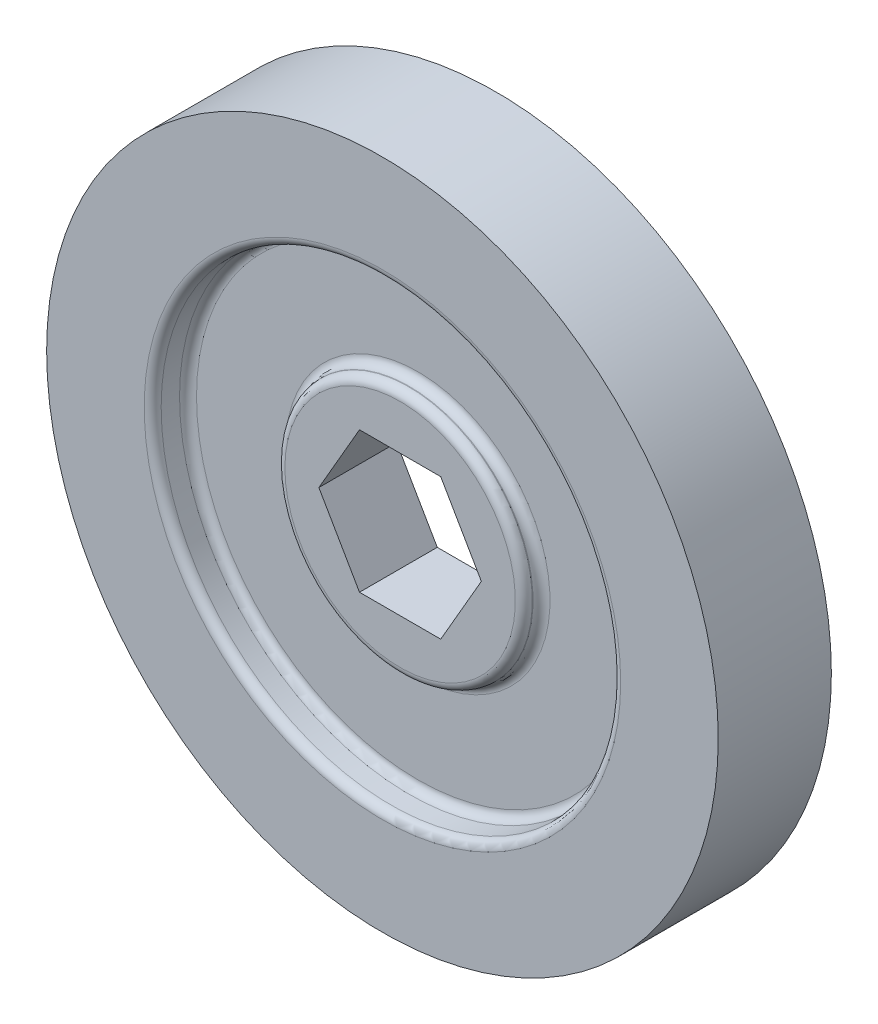
from build123d import *

# Parameters (mm, degrees)
BOSS_EXTRUDE1_DEPTH      = 5.08
BOSS_EXTRUDE1_DEPTH_BACK = 5.08
SKETCH1_R                = 30.1625
CUT_EXTRUDE1_DEPTH       = 44.849497289
FILLET1_R                = 0.762
FILLET2_R                = 0.762


with BuildPart() as part:
    # Sketch1 → Boss-Extrude1 (new, two sides: drawn at the far end of the back side and taken through both)
    with BuildSketch(Plane.XY.offset(-BOSS_EXTRUDE1_DEPTH_BACK)):
        Circle(SKETCH1_R)
    extrude(amount=BOSS_EXTRUDE1_DEPTH + BOSS_EXTRUDE1_DEPTH_BACK)

    # Sketch2 → Cut-Extrude1 (cut, through all)
    with BuildSketch(Plane.XY.offset(5.08)):
        Polygon((3.648853701, 6.32), (-3.648853701, 6.32), (-7.297707403, 0), (-3.648853701, -6.32), (3.648853701, -6.32), (7.297707403, 0), align=None)
    extrude(amount=-CUT_EXTRUDE1_DEPTH, mode=Mode.SUBTRACT)

    # Sketch3 → Cut-Revolve1 (revolve, cut)
    with BuildSketch(Plane(origin=(0, 0, 0), x_dir=(0, 0, -1), z_dir=(1, 0, 0))):
        Polygon((3.4925, 11.1125), (1.905, 11.1125), (1.905, 20.6375), (5.08, 20.6375), (5.08, 0), (3.4925, 0), align=None)
    cut_revolve1 = revolve(axis=Axis((0, 0, -22.753035396), (0, 0, 1)), mode=Mode.SUBTRACT)

    # Fillet1
    fillet1_edges = [part.edges().sort_by_distance(p)[0] for p in [
        (0, -11.1125, -1.905),
        (0, -20.6375, -5.08),
        (0, -11.1125, -3.4925),
    ]]
    fillet(fillet1_edges, radius=FILLET1_R)

    # Mirror1: Cut-Revolve1 across plane
    add(cut_revolve1.mirror(Plane.XY), mode=Mode.SUBTRACT)

    # Fillet2
    fillet2_edges = [part.edges().sort_by_distance(p)[0] for p in [
        (0, -20.6375, 5.08),
        (0, -20.6375, 1.905),
        (0, -11.1125, 1.905),
        (0, -11.1125, 3.4925),
    ]]
    fillet(fillet2_edges, radius=FILLET2_R)


solid = part.part
